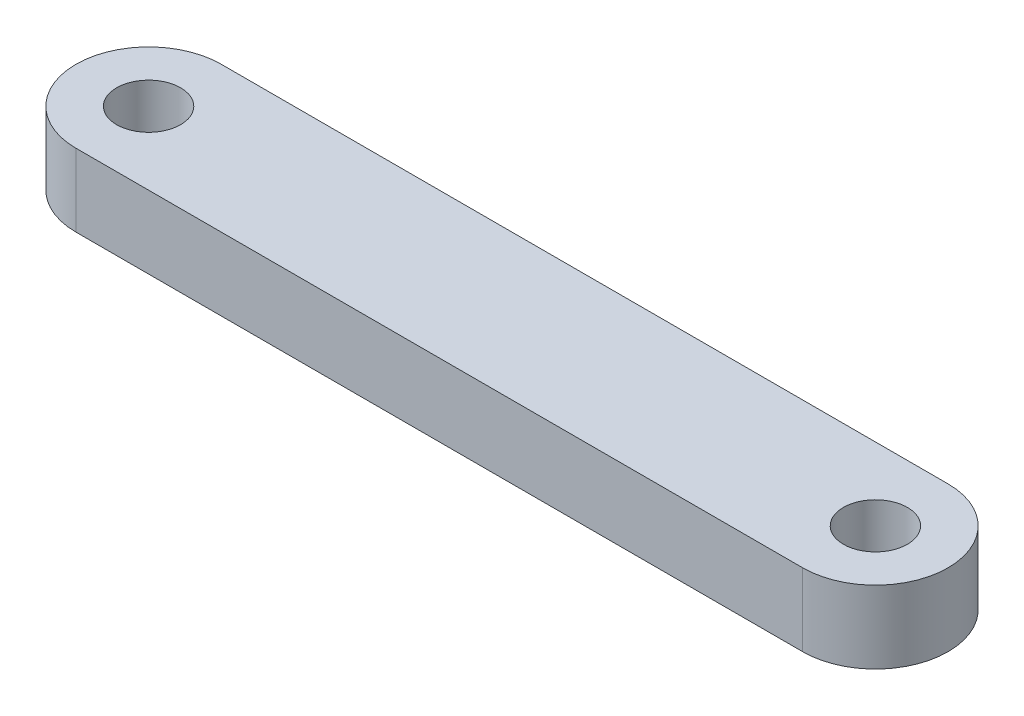
from build123d import *

# Parameters (mm, degrees)
SKETCH_1_R      = 2.2
EXTRUDE_2_DEPTH = 5


with BuildPart() as part:
    # 草图1 → 凸台-拉伸2 (new body)
    with BuildSketch(Plane(origin=(0, 0, 0), x_dir=(1, 0, 0), z_dir=(0, 1, 0))):
        with BuildLine():
            Line((0, 5), (50, 5))
            ThreePointArc((50, 5), (55, 0), (50, -5))
            Line((50, -5), (0, -5))
            ThreePointArc((0, -5), (-5, 0), (0, 5))
        make_face()
        with Locations(Location((0, 0, 0), (0, 0, 270))):
            Circle(SKETCH_1_R, mode=Mode.SUBTRACT)
        with Locations(Location((50, 0, 0), (0, 0, 270))):
            Circle(SKETCH_1_R, mode=Mode.SUBTRACT)
    extrude(amount=EXTRUDE_2_DEPTH)


solid = part.part
